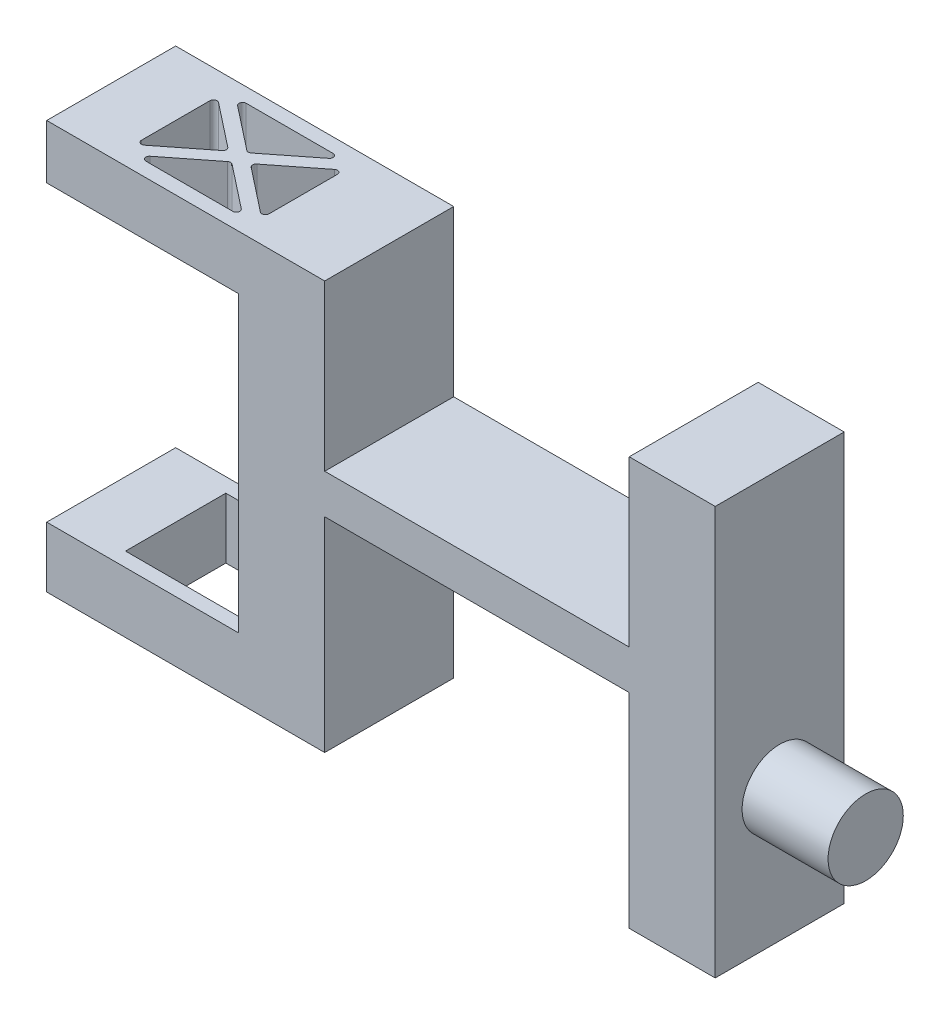
from build123d import *

# Parameters (mm, degrees)
SKETCH2_W                = 66.5
SKETCH2_H                = 55
SKETCH2_W_2              = 42.5
SKETCH2_H_2              = 20.5
BOSS_EXTRUDE1_DEPTH      = 18
SKETCH5_W                = 2
SKETCH5_H                = 6
BOSS_EXTRUDE2_DEPTH      = 26.8
BOSS_EXTRUDE3_REACH      = 89.768
SKETCH6_W                = 3
SKETCH6_H                = 6
SKETCH6_W_2              = 2
CUT_EXTRUDE3_REACH       = 90.155
SKETCH8_W                = 42
SKETCH8_H                = 4.25
SKETCH8_W_2              = 42.5
SKETCH12_W               = 3
SKETCH12_H               = 6
BOSS_EXTRUDE7_DEPTH      = 14
SKETCH14_W               = 4
SKETCH14_H               = 6
BOSS_EXTRUDE8_DEPTH      = 16.8
BOSS_EXTRUDE9_DEPTH      = 14
BOSS_EXTRUDE9_DEPTH_BACK = 1
SKETCH17_W               = 23.8
SKETCH17_H               = 6
SKETCH18_W               = 19.8
SKETCH18_H               = 14
CUT_EXTRUDE4_DEPTH       = 10
SKETCH20_W               = 5
SKETCH20_H               = 14
BOSS_EXTRUDE10_DEPTH     = 6
SKETCH22_W               = 38.8
SKETCH22_H               = 18
BOSS_EXTRUDE11_DEPTH     = 1
SKETCH23_W               = 26.8
SKETCH23_H               = 18
BOSS_EXTRUDE12_DEPTH     = 1
BOSS_EXTRUDE13_DEPTH     = 1
SKETCH25_W               = 12
SKETCH25_H               = 18
BOSS_EXTRUDE14_DEPTH     = 1
SKETCH27_W               = 38.8
SKETCH27_H               = 18
SKETCH27_W_2             = 19.8
SKETCH27_H_2             = 14
BOSS_EXTRUDE15_DEPTH     = 1
SKETCH28_W               = 12
SKETCH28_H               = 18
BOSS_EXTRUDE16_DEPTH     = 1
SKETCH32_W               = 18
SKETCH32_H               = 2.75
CUT_EXTRUDE8_DEPTH       = 26.8
SKETCH33_W               = 38.8
SKETCH33_H               = 18
SKETCH33_W_2             = 19.8
SKETCH33_H_2             = 14
BOSS_EXTRUDE17_DEPTH     = 2.75
SKETCH34_W               = 12
SKETCH34_H               = 18
BOSS_EXTRUDE18_DEPTH     = 2.75
SKETCH35_W               = 26.8
SKETCH35_H               = 18
BOSS_EXTRUDE19_DEPTH     = 2.3
SKETCH36_W               = 12
SKETCH36_H               = 18
SKETCH36_W_2             = 38.8
CUT_EXTRUDE9_DEPTH       = 2.75
SKETCH37_R               = 2.5
CUT_EXTRUDE10_DEPTH      = 6
SKETCH39_R               = 2.5
CUT_EXTRUDE12_DEPTH      = 10
SKETCH38_R               = 2.5
CUT_EXTRUDE11_DEPTH      = 6
SKETCH40_W               = 0.5
SKETCH40_H               = 4.25
CUT_EXTRUDE13_DEPTH      = 18
BOSS_EXTRUDE21_DEPTH     = 0.45
SKETCH44_R               = 5.25
BOSS_EXTRUDE22_DEPTH     = 12
SKETCH45_W               = 14
SKETCH45_H               = 8.45
BOSS_EXTRUDE23_DEPTH     = 2
CUT_EXTRUDE14_DEPTH      = 95.506891283
FILLET1_R                = 0.5


with BuildPart() as part:
    # Sketch2 → Boss-Extrude1 (new body)
    with BuildSketch(Plane.XY):
        with Locations((33.25, 27.5)):
            Rectangle(SKETCH2_W, SKETCH2_H)
        with Locations((33.25, 40.5)):
            Rectangle(SKETCH2_W_2, SKETCH2_H_2, mode=Mode.SUBTRACT)
        with Locations((33.25, 14.5)):
            Rectangle(SKETCH2_W_2, SKETCH2_H_2, mode=Mode.SUBTRACT)
    extrude(amount=BOSS_EXTRUDE1_DEPTH)

    # Sketch5 → Boss-Extrude2 (add)
    with BuildSketch(Plane.ZY):
        with Locations((1, 52)):
            Rectangle(SKETCH5_W, SKETCH5_H)
        with Locations((17, 52)):
            Rectangle(SKETCH5_W, SKETCH5_H)
        with Locations((1, 3)):
            Rectangle(SKETCH5_W, SKETCH5_H)
        with Locations((17, 3)):
            Rectangle(SKETCH5_W, SKETCH5_H)
    extrude(amount=BOSS_EXTRUDE2_DEPTH)

    # Sketch6 → Boss-Extrude3 (add, up to next)
    with BuildSketch(Plane.XY.offset(2), mode=Mode.PRIVATE) as boss_extrude3_sk1:
        with Locations((-25.3, 52)):
            Rectangle(SKETCH6_W, SKETCH6_H)
    boss_extrude3_tool1 = extrude(boss_extrude3_sk1.sketch, amount=BOSS_EXTRUDE3_REACH, mode=Mode.PRIVATE) - part.part
    # Sketch6 → Boss-Extrude3 (add, up to next)
    with BuildSketch(Plane.XY.offset(2), mode=Mode.PRIVATE) as boss_extrude3_sk2:
        with Locations((-25.8, 3)):
            Rectangle(SKETCH6_W_2, SKETCH6_H)
    boss_extrude3_tool2 = extrude(boss_extrude3_sk2.sketch, amount=BOSS_EXTRUDE3_REACH, mode=Mode.PRIVATE) - part.part
    add(boss_extrude3_tool1.solids().sort_by_distance((-25.3, 52, 2))[0])
    add(boss_extrude3_tool2.solids().sort_by_distance((-25.8, 3, 2))[0])

    # Sketch8 → Cut-Extrude3 (cut, up to next)
    with BuildSketch(Plane.XY.offset(18), mode=Mode.PRIVATE) as cut_extrude3_sk1:
        with Locations((33, 52.875)):
            Rectangle(SKETCH8_W, SKETCH8_H)
    cut_extrude3_tool1 = extrude(cut_extrude3_sk1.sketch, amount=-CUT_EXTRUDE3_REACH, mode=Mode.PRIVATE) & part.part
    # Sketch8 → Cut-Extrude3 (cut, up to next)
    with BuildSketch(Plane.XY.offset(18), mode=Mode.PRIVATE) as cut_extrude3_sk2:
        with Locations((33.25, 2.125)):
            Rectangle(SKETCH8_W_2, SKETCH8_H)
    cut_extrude3_tool2 = extrude(cut_extrude3_sk2.sketch, amount=-CUT_EXTRUDE3_REACH, mode=Mode.PRIVATE) & part.part
    add(cut_extrude3_tool1.solids().sort_by_distance((33, 52.875, 18))[0], mode=Mode.SUBTRACT)
    add(cut_extrude3_tool2.solids().sort_by_distance((33.25, 2.125, 18))[0], mode=Mode.SUBTRACT)

    # Sketch12 → Boss-Extrude7 (add)
    with BuildSketch(Plane.XY.offset(2)):
        with Locations((-6.5, 3)):
            Rectangle(SKETCH12_W, SKETCH12_H)
    extrude(amount=BOSS_EXTRUDE7_DEPTH)

    # Sketch14 → Boss-Extrude8 (add)
    with BuildSketch(Plane.ZY.offset(8)):
        with Locations((9, 3)):
            Rectangle(SKETCH14_W, SKETCH14_H)
    extrude(amount=BOSS_EXTRUDE8_DEPTH)

    # Sketch17 → Boss-Extrude9 (add, two sides: drawn at the far end of the back side and taken through both)
    with BuildSketch(Plane.XY.offset(2).offset(-BOSS_EXTRUDE9_DEPTH_BACK)):
        with Locations((-11.9, 52)):
            Rectangle(SKETCH17_W, SKETCH17_H)
    extrude(amount=BOSS_EXTRUDE9_DEPTH + BOSS_EXTRUDE9_DEPTH_BACK)

    # Sketch18 → Cut-Extrude4 (cut)
    with BuildSketch(Plane(origin=(0, 6, 0), x_dir=(1, 0, 0), z_dir=(0, 1, 0))):
        with Locations((-14.9, -9)):
            Rectangle(SKETCH18_W, SKETCH18_H)
    extrude(amount=-CUT_EXTRUDE4_DEPTH, mode=Mode.SUBTRACT)

    # Sketch20 → Boss-Extrude10 (add)
    with BuildSketch(Plane(origin=(0, 6, 0), x_dir=(1, 0, 0), z_dir=(0, 1, 0))):
        with Locations((-22.3, -9)):
            Rectangle(SKETCH20_W, SKETCH20_H)
    extrude(amount=-BOSS_EXTRUDE10_DEPTH)

    # Sketch22 → Boss-Extrude11 (add)
    with BuildSketch(Plane(origin=(0, 55, 0), x_dir=(1, 0, 0), z_dir=(0, 1, 0))):
        with Locations((-7.4, -9)):
            Rectangle(SKETCH22_W, SKETCH22_H)
    extrude(amount=BOSS_EXTRUDE11_DEPTH)

    # Sketch23 → Boss-Extrude12 (add)
    with BuildSketch(Plane.XZ.offset(-49)):
        with Locations((-13.4, 9)):
            Rectangle(SKETCH23_W, SKETCH23_H)
    extrude(amount=BOSS_EXTRUDE12_DEPTH)

    # Sketch24 → Boss-Extrude13 (add)
    with BuildSketch(Plane(origin=(0, 6, 0), x_dir=(1, 0, 0), z_dir=(0, 1, 0))):
        Polygon((0, 0), (-26.8, 0), (-26.8, -18), (0, -18), (0, -16), (-19.8, -16), (-19.8, -2), (0, -2), align=None)
    extrude(amount=BOSS_EXTRUDE13_DEPTH)

    # Sketch25 → Boss-Extrude14 (add)
    with BuildSketch(Plane(origin=(0, 55, 0), x_dir=(1, 0, 0), z_dir=(0, 1, 0))):
        with Locations((60.5, -9)):
            Rectangle(SKETCH25_W, SKETCH25_H)
    extrude(amount=BOSS_EXTRUDE14_DEPTH)

    # Sketch27 → Boss-Extrude15 (add)
    with BuildSketch(Plane.XZ):
        with Locations((-7.4, 9)):
            Rectangle(SKETCH27_W, SKETCH27_H)
        with Locations((-9.9, 9)):
            Rectangle(SKETCH27_W_2, SKETCH27_H_2, mode=Mode.SUBTRACT)
    extrude(amount=BOSS_EXTRUDE15_DEPTH)

    # Sketch28 → Boss-Extrude16 (add)
    with BuildSketch(Plane.XZ):
        with Locations((60.5, 9)):
            Rectangle(SKETCH28_W, SKETCH28_H)
    extrude(amount=BOSS_EXTRUDE16_DEPTH)

    # Sketch32 → Cut-Extrude8 (cut)
    with BuildSketch(Plane.ZY.offset(26.8)):
        with Locations((9, 5.625)):
            Rectangle(SKETCH32_W, SKETCH32_H)
    extrude(amount=-CUT_EXTRUDE8_DEPTH, mode=Mode.SUBTRACT)

    # Sketch33 → Boss-Extrude17 (add)
    with BuildSketch(Plane.XZ.offset(1)):
        with Locations((-7.4, 9)):
            Rectangle(SKETCH33_W, SKETCH33_H)
        with Locations((-9.9, 9)):
            Rectangle(SKETCH33_W_2, SKETCH33_H_2, mode=Mode.SUBTRACT)
    extrude(amount=BOSS_EXTRUDE17_DEPTH)

    # Sketch34 → Boss-Extrude18 (add)
    with BuildSketch(Plane.XZ.offset(1)):
        with Locations((60.5, 9)):
            Rectangle(SKETCH34_W, SKETCH34_H)
    extrude(amount=BOSS_EXTRUDE18_DEPTH)

    # Sketch35 → Boss-Extrude19 (add)
    with BuildSketch(Plane.XZ.offset(-48)):
        with Locations((-13.4, 9)):
            Rectangle(SKETCH35_W, SKETCH35_H)
    extrude(amount=BOSS_EXTRUDE19_DEPTH)

    # Sketch36 → Cut-Extrude9 (cut)
    with BuildSketch(Plane(origin=(0, 56, 0), x_dir=(1, 0, 0), z_dir=(0, 1, 0))):
        with Locations((60.5, -9)):
            Rectangle(SKETCH36_W, SKETCH36_H)
        with Locations((-7.4, -9)):
            Rectangle(SKETCH36_W_2, SKETCH36_H)
    extrude(amount=-CUT_EXTRUDE9_DEPTH, mode=Mode.SUBTRACT)

    # Sketch37 → Cut-Extrude10 (cut)
    with BuildSketch(Plane.ZY.offset(26.8)):
        with Locations((4, 49.45)):
            Circle(SKETCH37_R)
        with Locations((14, 49.45)):
            Circle(SKETCH37_R)
    extrude(amount=-CUT_EXTRUDE10_DEPTH, mode=Mode.SUBTRACT)

    # Sketch39 → Cut-Extrude12 (cut)
    with BuildSketch(Plane(origin=(0, 0, 0), x_dir=(-1, 0, 0), z_dir=(0, 0, -1))):
        with Locations((-8.15, 19.75)):
            Circle(SKETCH39_R)
        with Locations((-8.15, 9.75)):
            Circle(SKETCH39_R)
        with Locations((-57.85, 19.75)):
            Circle(SKETCH39_R)
        with Locations((-57.85, 9.75)):
            Circle(SKETCH39_R)
        with Locations(Location((-8.15, 45.25, 0), (0, 0, 180))):
            Circle(SKETCH39_R)
        with Locations(Location((-8.15, 35.25, 0), (0, 0, 180))):
            Circle(SKETCH39_R)
        with Locations(Location((-57.85, 45.25, 0), (0, 0, 180))):
            Circle(SKETCH39_R)
        with Locations(Location((-57.85, 35.25, 0), (0, 0, 180))):
            Circle(SKETCH39_R)
    extrude(amount=-CUT_EXTRUDE12_DEPTH, mode=Mode.SUBTRACT)

    # Sketch38 → Cut-Extrude11 (cut)
    with BuildSketch(Plane.ZY.offset(26.8)):
        with Locations((4, 0.45)):
            Circle(SKETCH38_R)
        with Locations((14, 0.45)):
            Circle(SKETCH38_R)
    extrude(amount=-CUT_EXTRUDE11_DEPTH, mode=Mode.SUBTRACT)

    # Sketch40 → Cut-Extrude13 (cut)
    with BuildSketch(Plane(origin=(0, 0, 0), x_dir=(-1, 0, 0), z_dir=(0, 0, -1))):
        with Locations((-54.25, 52.875)):
            Rectangle(SKETCH40_W, SKETCH40_H)
    extrude(amount=-CUT_EXTRUDE13_DEPTH, mode=Mode.SUBTRACT)

    # Sketch43 → Boss-Extrude21 (add)
    with BuildSketch(Plane(origin=(0, 4.25, 0), x_dir=(1, 0, 0), z_dir=(0, 1, 0))):
        Polygon((0, 0), (-26.8, 0), (-26.8, -18), (0, -18), (0, -16), (-19.8, -16), (-19.8, -2), (0, -2), align=None)
    extrude(amount=BOSS_EXTRUDE21_DEPTH)

    # Sketch44 → Boss-Extrude22 (add)
    with BuildSketch(Plane(origin=(66.5, 0, 0), x_dir=(0, 0, -1), z_dir=(1, 0, 0))):
        with Locations(Location((-9, 14.75, 0), (0, 0, 180))):
            Circle(SKETCH44_R)
    extrude(amount=BOSS_EXTRUDE22_DEPTH)

    # Sketch45 → Boss-Extrude23 (add)
    with BuildSketch(Plane(origin=(-19.8, 0, 0), x_dir=(0, 0, -1), z_dir=(1, 0, 0))):
        with Locations((-9, 0.475)):
            Rectangle(SKETCH45_W, SKETCH45_H)
    extrude(amount=BOSS_EXTRUDE23_DEPTH)

    # Sketch48 → Cut-Extrude14 (cut, through all)
    with BuildSketch(Plane(origin=(0, 45.7, 0), x_dir=(-1, 0, 0), z_dir=(0, -1, 0))):
        Polygon((8.9, -16), (1.4, -16), (8.9, -10.101152658), (16.399963049, -16), align=None)
        Polygon((1.398571429, -2), (8.9, -7.9), (16.401428571, -2), align=None)
        Polygon((0, -3.2), (7.374285714, -9), (0, -14.8), align=None)
        Polygon((17.8, -3.195910825), (10.420515192, -9), (17.8, -14.804089175), align=None)
    extrude(amount=-CUT_EXTRUDE14_DEPTH, mode=Mode.SUBTRACT)

    # Fillet1
    fillet1_edges = [part.edges().sort_by_distance(p)[0] for p in [
        (0, 49.475, 14.8),
        (0, 49.475, 3.2),
        (-7.374285714, 49.475, 9),
        (-17.8, 49.475, 14.804089175),
        (-10.420515192, 49.475, 9),
        (-17.8, 49.475, 3.195910825),
        (-8.9, 49.475, 10.101152658),
        (-16.399963049, 49.475, 16),
        (-1.4, 49.475, 16),
        (-16.401428571, 49.475, 2),
        (-8.9, 49.475, 7.9),
        (-1.398571429, 49.475, 2),
    ]]
    fillet(fillet1_edges, radius=FILLET1_R)


solid = part.part
